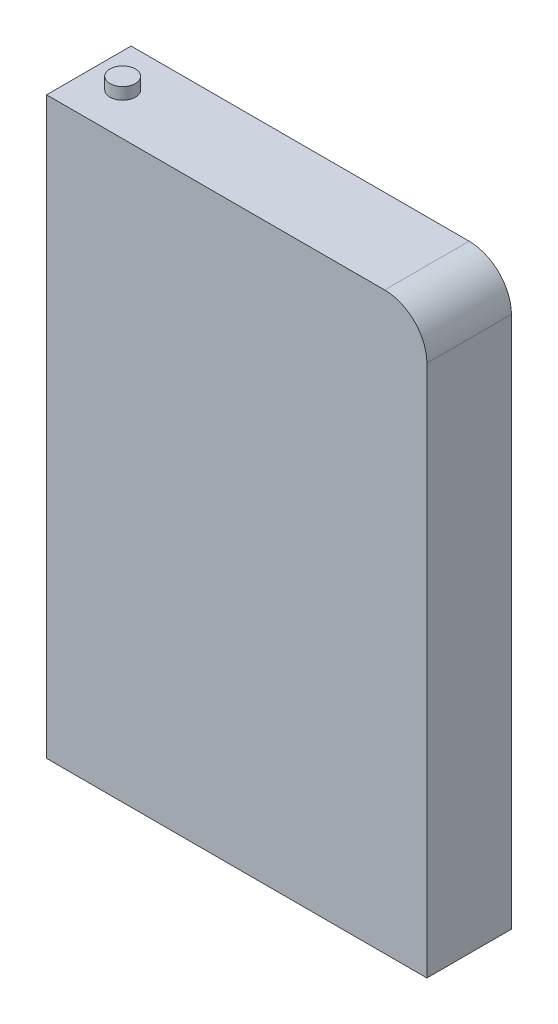
from build123d import *

# Parameters (mm, degrees)
SKETCH_1_W           = 45
SKETCH_1_H           = 68
EXTRUDE_1_DEPTH      = 10
FILLET_1_R           = 5
SKETCH_2_R           = 1.5
EXTRUDE_2_DEPTH      = 1.4
SKETCH_3_OUTSIDE_W   = 63.662
SKETCH_3_OUTSIDE_H   = 28.662
SKETCH_3_OUTSIDE_W_2 = 45
SKETCH_3_OUTSIDE_H_2 = 10
SKETCH_3_OUTSIDE_R   = 2.5
CUT_EXTRUDE_1_DEPTH  = 5


with BuildPart() as part:
    # 草图1 → 凸台-拉伸1 (new body)
    with BuildSketch(Plane.XY):
        Rectangle(SKETCH_1_W, SKETCH_1_H)
    extrude(amount=EXTRUDE_1_DEPTH)

    # 圆角1
    fillet_1_edges = [part.edges().sort_by_distance(p)[0] for p in [
        (22.5, 34, 5),
    ]]
    fillet(fillet_1_edges, radius=FILLET_1_R)

    # 草图2 → 凸台-拉伸2 (add)
    with BuildSketch(Plane(origin=(0, 34, 0), x_dir=(1, 0, 0), z_dir=(0, 1, 0))):
        with Locations(Location((-18.5, -5, 0), (0, 0, 90))):
            Circle(SKETCH_2_R)
    extrude(amount=EXTRUDE_2_DEPTH)

    # 草图3 outside → 切除-拉伸1 (cut)
    # profile 1 of 2: a face of its own
    with BuildSketch(Plane.XZ.offset(34)):
        with Locations((0, 5)):
            Rectangle(SKETCH_3_OUTSIDE_W, SKETCH_3_OUTSIDE_H)
        with Locations((0, 5)):
            Rectangle(SKETCH_3_OUTSIDE_W_2, SKETCH_3_OUTSIDE_H_2, mode=Mode.SUBTRACT)
    # profile 2 of 2: a face of its own
    with BuildSketch(Plane.XZ.offset(34)):
        with Locations(Location((-18.5, 5, 0), (0, 0, 270))):
            Circle(SKETCH_3_OUTSIDE_R)
    extrude(amount=-CUT_EXTRUDE_1_DEPTH, mode=Mode.SUBTRACT)


solid = part.part
